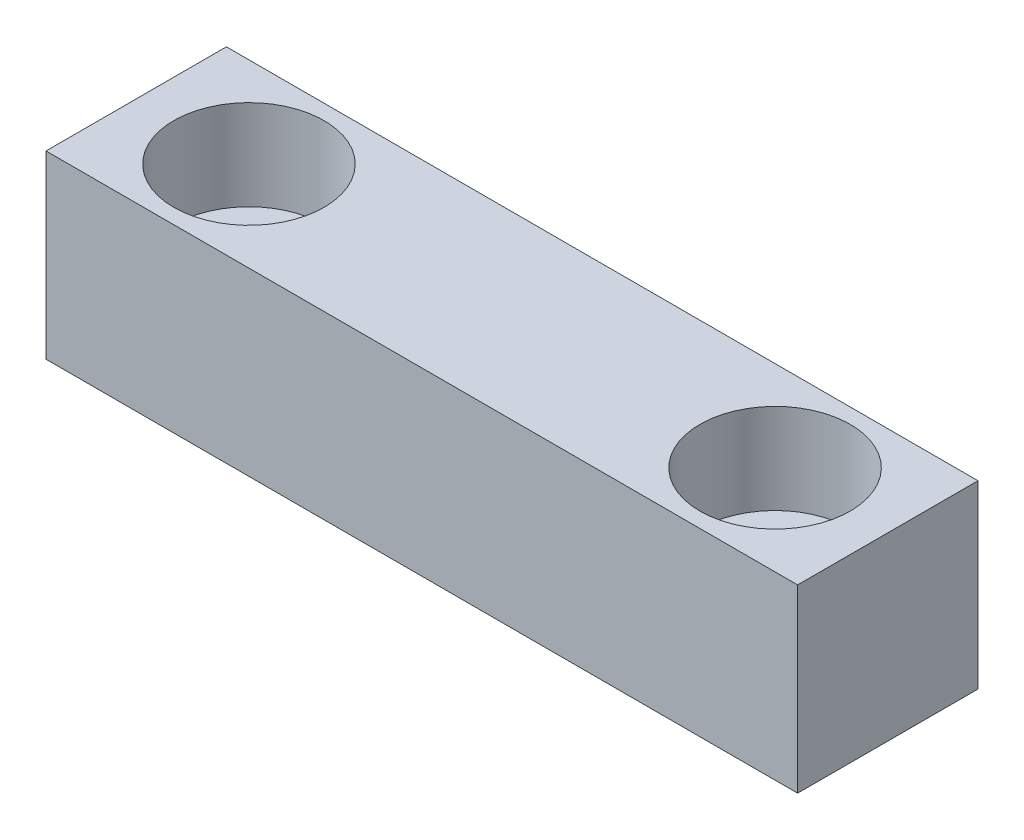
from build123d import *

# Parameters (mm, degrees)
SKETCH1_W                                           = 50
SKETCH1_H                                           = 12
BOSS_EXTRUDE1_DEPTH                                 = 6
CBORE_FOR_M5_HEX_SOCKET_HEAD_CAP_SCREW1_D           = 5.5
CBORE_FOR_M5_HEX_SOCKET_HEAD_CAP_SCREW1_CBORE_D     = 10
CBORE_FOR_M5_HEX_SOCKET_HEAD_CAP_SCREW1_CBORE_DEPTH = 6


with BuildPart() as part:
    # Sketch1 → Boss-Extrude1 (new, symmetric)
    with BuildSketch(Plane(origin=(0, 0, 0), x_dir=(1, 0, 0), z_dir=(0, 1, 0))):
        with Locations((25, 6)):
            Rectangle(SKETCH1_W, SKETCH1_H)
    extrude(amount=BOSS_EXTRUDE1_DEPTH, both=True)

    # CBORE for M5 Hex Socket Head Cap Screw1 (through all)
    with Locations(Plane(origin=(0, 6, 0), x_dir=(1, 0, 0), z_dir=(0, 1, 0))):
        with Locations((42.5, 6), (7.5, 6)):
            CounterBoreHole(CBORE_FOR_M5_HEX_SOCKET_HEAD_CAP_SCREW1_D / 2, CBORE_FOR_M5_HEX_SOCKET_HEAD_CAP_SCREW1_CBORE_D / 2, CBORE_FOR_M5_HEX_SOCKET_HEAD_CAP_SCREW1_CBORE_DEPTH)


solid = part.part
